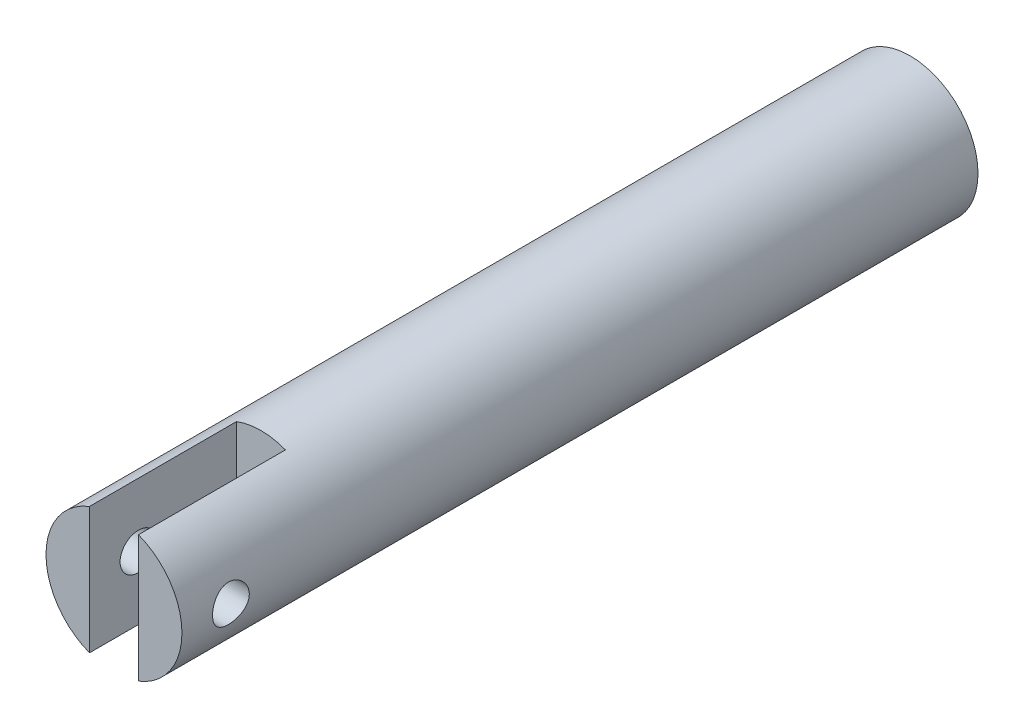
from build123d import *

# Parameters (mm, degrees)
ESQUISSE1_R                  = 5.55
BOSS_EXTRU_1_DEPTH           = 65
ENL_V_START                  = -12
ENL_V_MAT_EXTRU_1_DEPTH      = 12
ENL_V_MAT_EXTRU_2_DEPTH      = 66.47216966
ENL_V_MAT_EXTRU_2_DEPTH_BACK = 66.47216966
ESQUISSE3_R                  = 1.5


with BuildPart() as part:
    # Esquisse1 → Boss.-Extru.1 (new body)
    with BuildSketch(Plane.XY):
        Circle(ESQUISSE1_R)
    extrude(amount=BOSS_EXTRU_1_DEPTH)

    # Esquisse2 → Enlèv. mat.-Extru.1 (cut)
    with BuildSketch(Plane.XY.offset(65).offset(ENL_V_START)):
        with BuildLine():
            Line((-2, 5.177113095), (-2, -5.177113095))
            ThreePointArc((-2, -5.177113095), (0, -5.55), (2, -5.177113095))
            Line((2, -5.177113095), (2, 5.177113095))
            ThreePointArc((2, 5.177113095), (0, 5.55), (-2, 5.177113095))
        make_face()
    extrude(amount=ENL_V_MAT_EXTRU_1_DEPTH, mode=Mode.SUBTRACT)

    # Esquisse3 → Enlèv. mat.-Extru.2 (cut, two sides: drawn at the far end of the back side and taken through both)
    with BuildSketch(Plane(origin=(0, 0, 0), x_dir=(0, 0, -1), z_dir=(1, 0, 0)).offset(-ENL_V_MAT_EXTRU_2_DEPTH_BACK)):
        with Locations((-61, 0)):
            Circle(ESQUISSE3_R)
    extrude(amount=ENL_V_MAT_EXTRU_2_DEPTH + ENL_V_MAT_EXTRU_2_DEPTH_BACK, mode=Mode.SUBTRACT)


solid = part.part
